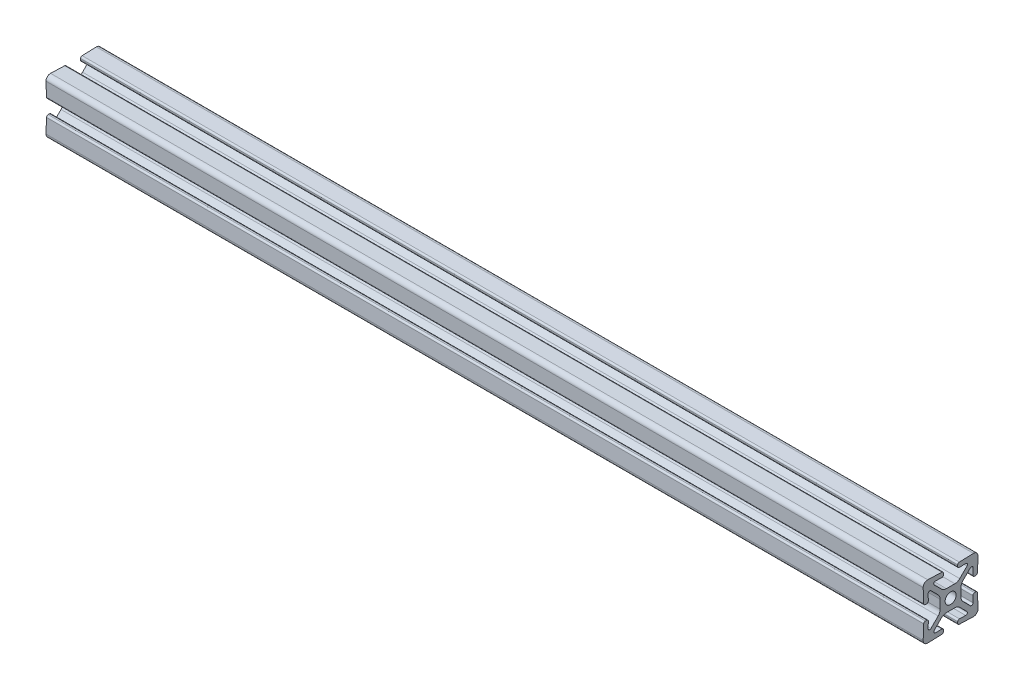
from build123d import *

# Parameters (mm, degrees)
BOSS_EXTRUDE1_DEPTH      = 203.2
BOSS_EXTRUDE1_DEPTH_BACK = 203.2


with BuildPart() as part:
    # Sketch3 → Boss-Extrude1 (new, two sides: drawn at the far end of the back side and taken through both)
    with BuildSketch(Plane(origin=(0, 0, 0), x_dir=(0, 0, -1), z_dir=(1, 0, 0)).offset(-BOSS_EXTRUDE1_DEPTH_BACK)):
        with BuildLine():
            Line((0, 4.826), (1.984228399, 4.826))
            ThreePointArc((1.984228399, 4.826), (3.199248297, 5.067682484), (4.229292429, 5.75593597))
            Line((4.229292429, 5.75593597), (7.586577723, 9.113221264))
            ThreePointArc((7.586577723, 9.113221264), (7.746562132, 9.955883421), (7.021168939, 10.413572441))
            Line((7.021168939, 10.413572441), (4.090593416, 10.311234489))
            ThreePointArc((4.090593416, 10.311234489), (3.534670322, 10.524633371), (3.302, 11.072770299))
            Line((3.302, 11.072770299), (3.302, 11.70815736))
            ThreePointArc((3.302, 11.70815736), (3.515863072, 12.237487038), (4.037406584, 12.46969317))
            Line((4.037406584, 12.46969317), (10.597084223, 12.698762161))
            ThreePointArc((10.597084223, 12.698762161), (12.104840979, 12.104840979), (12.698762161, 10.597084223))
            Line((12.698762161, 10.597084223), (12.46969317, 4.037406584))
            ThreePointArc((12.46969317, 4.037406584), (12.237487038, 3.515863072), (11.70815736, 3.302))
            Line((11.70815736, 3.302), (11.072770299, 3.302))
            ThreePointArc((11.072770299, 3.302), (10.524633371, 3.534670322), (10.311234489, 4.090593416))
            Line((10.311234489, 4.090593416), (10.413572441, 7.021168939))
            ThreePointArc((10.413572441, 7.021168939), (9.955883421, 7.746562132), (9.113221264, 7.586577723))
            Line((9.113221264, 7.586577723), (5.75593597, 4.229292429))
            ThreePointArc((5.75593597, 4.229292429), (5.067682484, 3.199248297), (4.826, 1.984228399))
            Line((4.826, 1.984228399), (4.826, 0))
            Line((4.826, 0), (2.54, 0))
            ThreePointArc((2.54, 0), (1.796051224, 1.796051224), (0, 2.54))
            Line((0, 2.54), (0, 4.826))
        make_face()
    extrude(amount=BOSS_EXTRUDE1_DEPTH + BOSS_EXTRUDE1_DEPTH_BACK)

    # Mirror1: part across plane


with BuildPart() as part_1:
    add(part.part)
    add(part.part.mirror(Plane.ZX))

    # Mirror2: part across plane


with BuildPart() as part_2:
    add(part_1.part)
    add(part_1.part.mirror(Plane.XY))


solid = part_2.part
